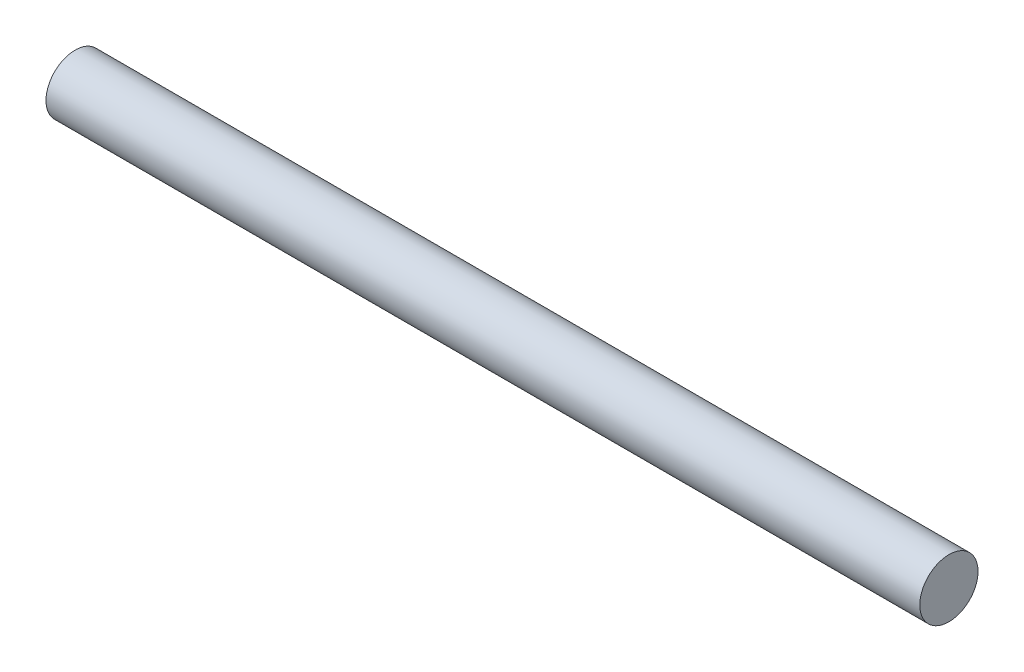
from build123d import *

# Parameters (mm, degrees)
SKETCH1_R           = 6
BOSS_EXTRUDE1_DEPTH = 180


with BuildPart() as part:
    # Sketch1 → Boss-Extrude1 (new body)
    with BuildSketch(Plane(origin=(0, 0, 0), x_dir=(0, 0, -1), z_dir=(1, 0, 0))):
        with Locations(Location((0, 0, 0), (0, 0, 180))):
            Circle(SKETCH1_R)
    extrude(amount=BOSS_EXTRUDE1_DEPTH)


solid = part.part
